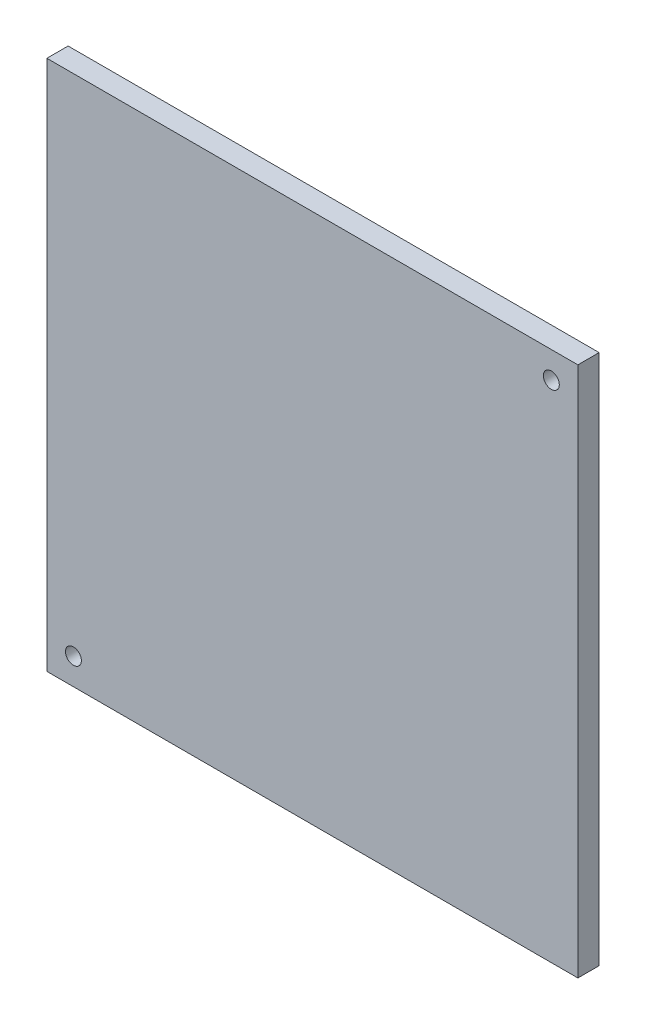
from build123d import *

# Parameters (mm, degrees)
SKETCH_1_W      = 100
SKETCH_1_H      = 100
SKETCH_1_R      = 1.5
EXTRUDE_1_DEPTH = 4


with BuildPart() as part:
    # 草图1 → 凸台-拉伸1 (new body)
    with BuildSketch(Plane.XY):
        Rectangle(SKETCH_1_W, SKETCH_1_H)
        with Locations((45, 45)):
            Circle(SKETCH_1_R, mode=Mode.SUBTRACT)
        with Locations((-45, -45)):
            Circle(SKETCH_1_R, mode=Mode.SUBTRACT)
    extrude(amount=EXTRUDE_1_DEPTH)


solid = part.part
